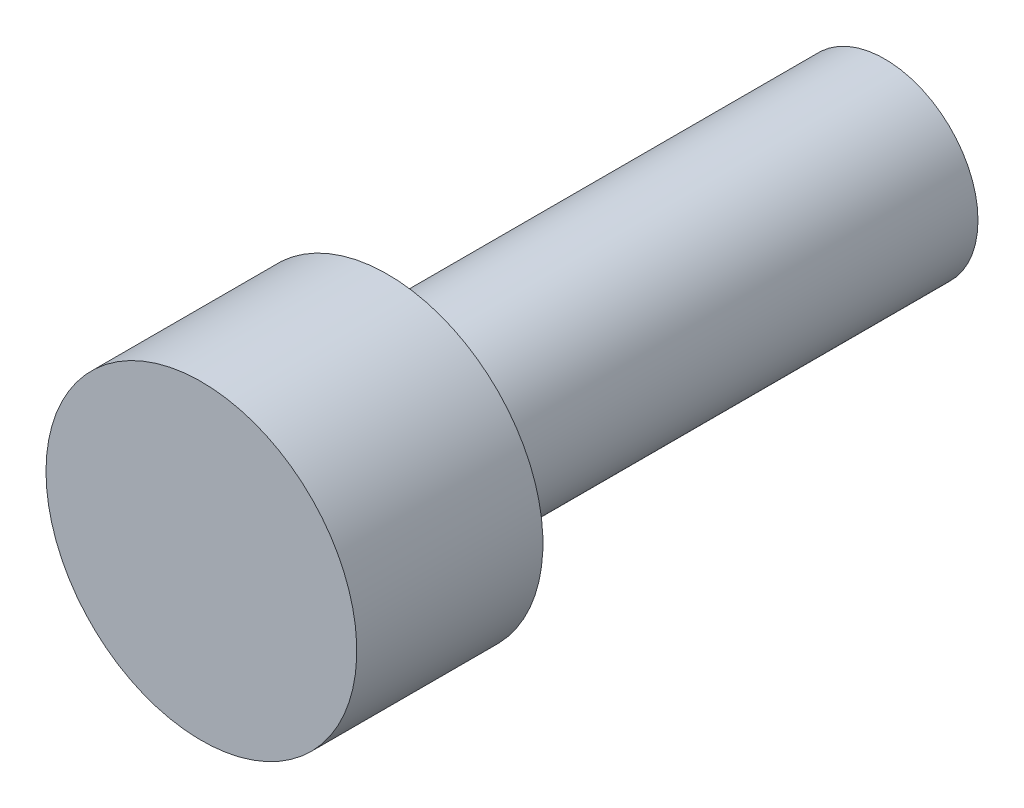
from build123d import *

# Parameters (mm, degrees)
SKETCH_1_R      = 3
EXTRUDE_1_DEPTH = 16
SKETCH_2_R      = 5
EXTRUDE_2_DEPTH = 5.99


with BuildPart() as part:
    # 草图1 → 凸台-拉伸1 (new body)
    with BuildSketch(Plane.XY):
        Circle(SKETCH_1_R)
    extrude(amount=-EXTRUDE_1_DEPTH)

    # 草图2 → 凸台-拉伸2 (add)
    with BuildSketch(Plane.XY):
        with Locations(Location((0, 0, 0), (0, 0, 180))):
            Circle(SKETCH_2_R)
    extrude(amount=EXTRUDE_2_DEPTH)


solid = part.part
